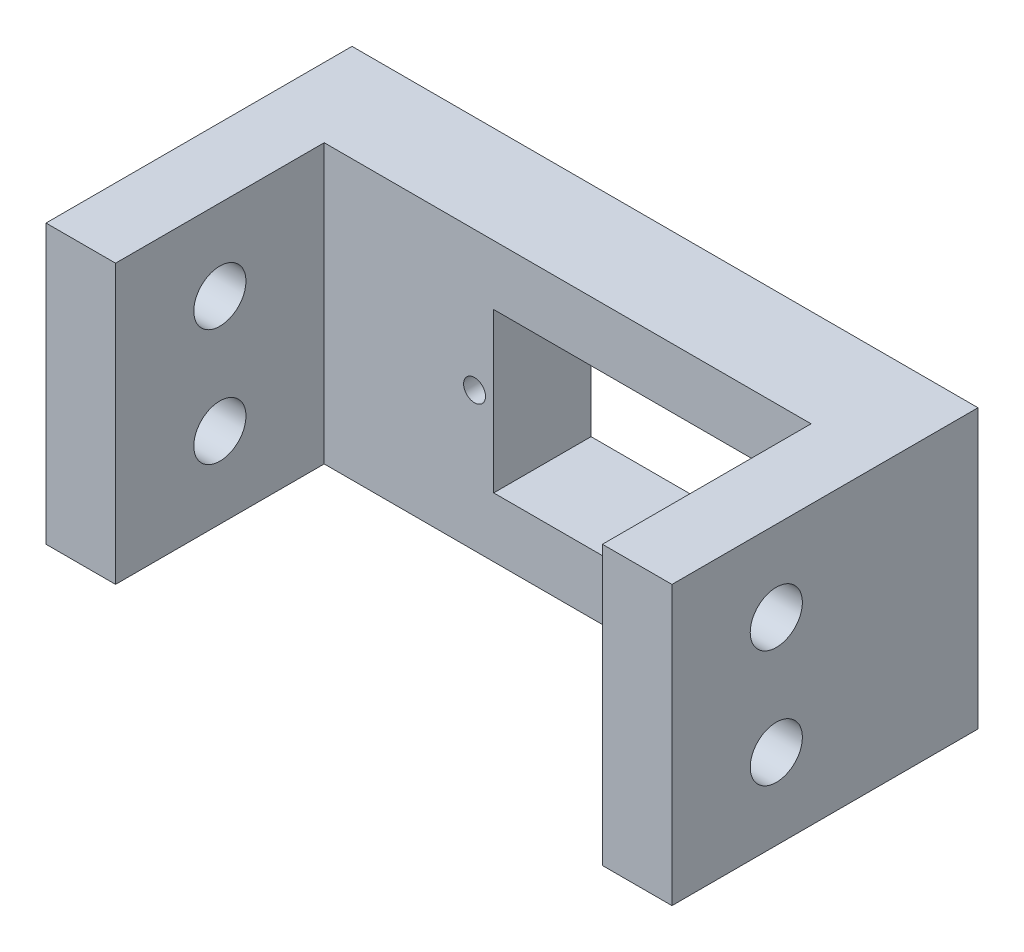
from build123d import *

# Parameters (mm, degrees)
BOSS_EXTRUDE1_DEPTH     = 25.4
CUT_EXTRUDE1_DEPTH      = 60.905780189
CUT_EXTRUDE1_DEPTH_BACK = 60.905780189
SKETCH2_R               = 2.38125
SKETCH3_R               = 1
SKETCH3_W               = 24
SKETCH3_H               = 14.5
CUT_EXTRUDE2_DEPTH      = 48.353291596


with BuildPart() as part:
    # Sketch1 → Boss-Extrude1 (new body)
    with BuildSketch(Plane(origin=(0, 0, 0), x_dir=(1, 0, 0), z_dir=(0, 1, 0))):
        Polygon((-28.575, 8.89), (28.575, 8.89), (28.575, -19.05), (22.225, -19.05), (22.225, 0), (-22.225, 0), (-22.225, -19.05), (-28.575, -19.05), align=None)
    extrude(amount=BOSS_EXTRUDE1_DEPTH)

    # Sketch2 → Cut-Extrude1 (cut, two sides: drawn at the far end of the back side and taken through both)
    with BuildSketch(Plane.ZY.offset(-22.225).offset(-CUT_EXTRUDE1_DEPTH_BACK)):
        with Locations((9.525, 18.034)):
            Circle(SKETCH2_R)
        with Locations(Location((9.525, 7.366, 0), (0, 0, 180))):
            Circle(SKETCH2_R)
    extrude(amount=CUT_EXTRUDE1_DEPTH + CUT_EXTRUDE1_DEPTH_BACK, mode=Mode.SUBTRACT)

    # Sketch3 → Cut-Extrude2 (cut, through all)
    with BuildSketch(Plane(origin=(0, 0, -8.89), x_dir=(-1, 0, 0), z_dir=(0, 0, -1))):
        with Locations((8.5, 12.7)):
            Circle(SKETCH3_R)
        with Locations((-19, 12.7)):
            Circle(SKETCH3_R)
        with Locations((-5.25, 12.7)):
            Rectangle(SKETCH3_W, SKETCH3_H)
    extrude(amount=-CUT_EXTRUDE2_DEPTH, mode=Mode.SUBTRACT)


solid = part.part
